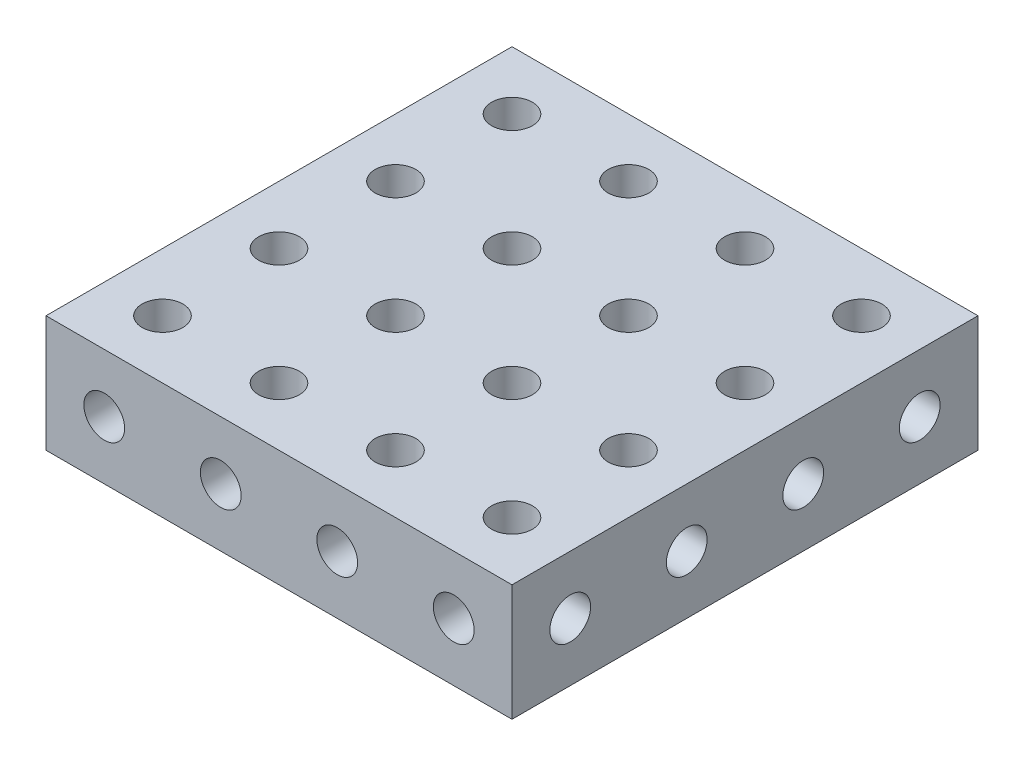
from build123d import *

# Parameters (mm, degrees)
ESQUISSE1_W             = 40
ESQUISSE1_H             = 10
BOSS_EXTRU_1_DEPTH      = 40
ESQUISSE2_R             = 1.75
ENL_V_MAT_EXTRU_1_DEPTH = 58.445626465
ESQUISSE3_R             = 1.75
ENL_V_MAT_EXTRU_2_DEPTH = 40
ESQUISSE4_R             = 1.75
ENL_V_MAT_EXTRU_3_DEPTH = 40


with BuildPart() as part:
    # Esquisse1 → Boss.-Extru.1 (new body)
    with BuildSketch(Plane(origin=(0, 0, 0), x_dir=(0, 0, -1), z_dir=(1, 0, 0))):
        with Locations((20, 5)):
            Rectangle(ESQUISSE1_W, ESQUISSE1_H)
    extrude(amount=BOSS_EXTRU_1_DEPTH)

    # Esquisse2 → Enlèv. mat.-Extru.1 (cut, through all)
    with BuildSketch(Plane(origin=(0, 10, 0), x_dir=(1, 0, 0), z_dir=(0, 1, 0))):
        with Locations(Location((5, 35, 0), (0, 0, 270))):
            Circle(ESQUISSE2_R)
        with Locations(Location((15, 35, 0), (0, 0, 270))):
            Circle(ESQUISSE2_R)
        with Locations(Location((25, 35, 0), (0, 0, 270))):
            Circle(ESQUISSE2_R)
        with Locations(Location((35, 35, 0), (0, 0, 270))):
            Circle(ESQUISSE2_R)
        with Locations(Location((5, 25, 0), (0, 0, 270))):
            Circle(ESQUISSE2_R)
        with Locations(Location((15, 25, 0), (0, 0, 270))):
            Circle(ESQUISSE2_R)
        with Locations(Location((25, 25, 0), (0, 0, 270))):
            Circle(ESQUISSE2_R)
        with Locations(Location((35, 25, 0), (0, 0, 270))):
            Circle(ESQUISSE2_R)
        with Locations(Location((5, 15, 0), (0, 0, 270))):
            Circle(ESQUISSE2_R)
        with Locations(Location((15, 15, 0), (0, 0, 270))):
            Circle(ESQUISSE2_R)
        with Locations(Location((25, 15, 0), (0, 0, 270))):
            Circle(ESQUISSE2_R)
        with Locations(Location((35, 15, 0), (0, 0, 270))):
            Circle(ESQUISSE2_R)
        with Locations(Location((5, 5, 0), (0, 0, 270))):
            Circle(ESQUISSE2_R)
        with Locations(Location((15, 5, 0), (0, 0, 270))):
            Circle(ESQUISSE2_R)
        with Locations(Location((25, 5, 0), (0, 0, 270))):
            Circle(ESQUISSE2_R)
        with Locations(Location((35, 5, 0), (0, 0, 270))):
            Circle(ESQUISSE2_R)
    extrude(amount=-ENL_V_MAT_EXTRU_1_DEPTH, mode=Mode.SUBTRACT)

    # Esquisse3 → Enlèv. mat.-Extru.2 (cut)
    with BuildSketch(Plane.XY):
        with Locations((5, 5)):
            Circle(ESQUISSE3_R)
        with Locations((15, 5)):
            Circle(ESQUISSE3_R)
        with Locations((25, 5)):
            Circle(ESQUISSE3_R)
        with Locations((35, 5)):
            Circle(ESQUISSE3_R)
    extrude(amount=-ENL_V_MAT_EXTRU_2_DEPTH, mode=Mode.SUBTRACT)

    # Esquisse4 → Enlèv. mat.-Extru.3 (cut)
    with BuildSketch(Plane(origin=(40, 0, 0), x_dir=(0, 0, -1), z_dir=(1, 0, 0))):
        with Locations((5, 5)):
            Circle(ESQUISSE4_R)
        with Locations((15, 5)):
            Circle(ESQUISSE4_R)
        with Locations((25, 5)):
            Circle(ESQUISSE4_R)
        with Locations(Location((35, 5, 0), (0, 0, 315))):
            Circle(ESQUISSE4_R)
    extrude(amount=-ENL_V_MAT_EXTRU_3_DEPTH, mode=Mode.SUBTRACT)


solid = part.part
